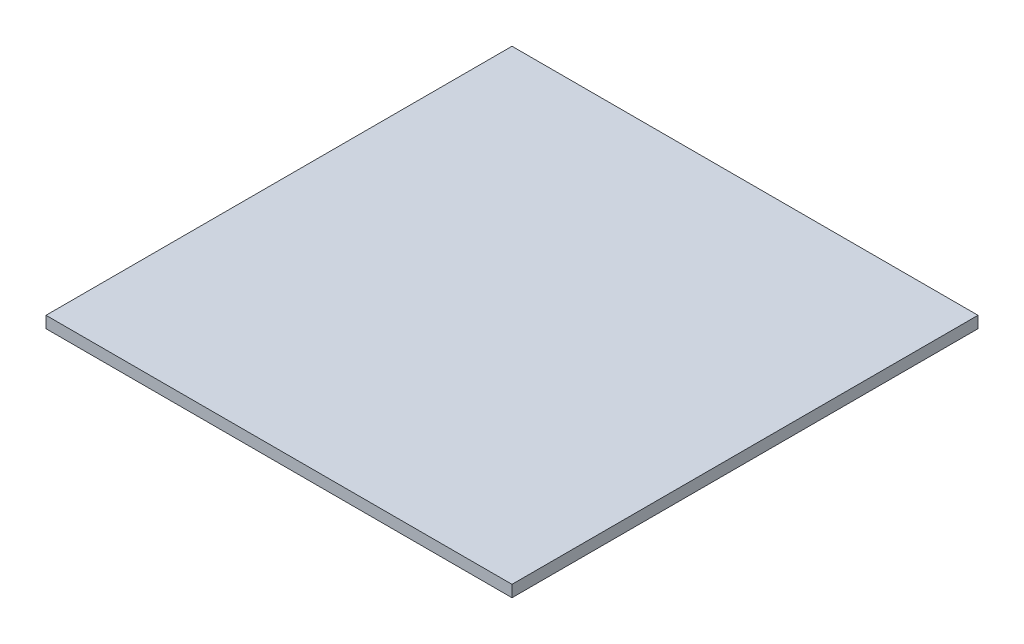
from build123d import *

# Parameters (mm, degrees)
SKETCH1_W           = 100
SKETCH1_H           = 100
BOSS_EXTRUDE1_DEPTH = 2.5


with BuildPart() as part:
    # Sketch1 → Boss-Extrude1 (new body)
    with BuildSketch(Plane(origin=(0, 0, 0), x_dir=(1, 0, 0), z_dir=(0, 1, 0))):
        Rectangle(SKETCH1_W, SKETCH1_H)
    extrude(amount=BOSS_EXTRUDE1_DEPTH)


solid = part.part
